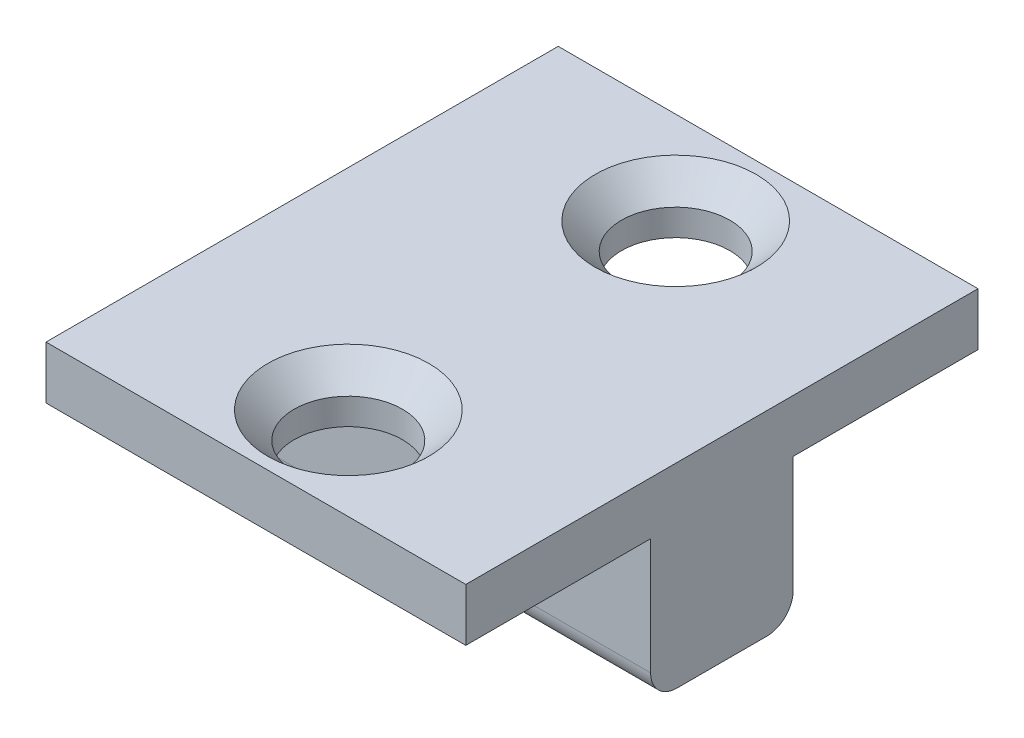
from build123d import *

# Parameters (mm, degrees)
SKETCH_1_W          = 15.9
SKETCH_1_H          = 5.4
EXTRUDE_1_DEPTH     = 5.4
SKETCH_2_W          = 15.9
SKETCH_2_H          = 19.4
EXTRUDE_2_DEPTH     = 2
SKETCH_3_R          = 2.05
CUT_EXTRUDE_2_DEPTH = 14.654761074
CHAMFER_1_SIZE      = 1
FILLET_1_R          = 1


with BuildPart() as part:
    # 草图1 → 凸台-拉伸1 (new body)
    with BuildSketch(Plane(origin=(0, 0, 0), x_dir=(1, 0, 0), z_dir=(0, 1, 0))):
        Rectangle(SKETCH_1_W, SKETCH_1_H)
    extrude(amount=EXTRUDE_1_DEPTH)

    # 草图2 → 凸台-拉伸2 (add)
    with BuildSketch(Plane(origin=(0, 5.4, 0), x_dir=(1, 0, 0), z_dir=(0, 1, 0))):
        Rectangle(SKETCH_2_W, SKETCH_2_H)
    extrude(amount=EXTRUDE_2_DEPTH)

    # 草图3 → 切除-拉伸2 (cut, through all)
    with BuildSketch(Plane(origin=(0, 5.4, 0), x_dir=(-1, 0, 0), z_dir=(0, -1, 0))):
        with Locations(Location((0, 6.2, 0), (0, 0, 90))):
            Circle(SKETCH_3_R)
    cut_extrude_2 = extrude(amount=-CUT_EXTRUDE_2_DEPTH, mode=Mode.SUBTRACT)

    # 镜向2: 切除-拉伸2 across plane
    add(cut_extrude_2.mirror(Plane.XY), mode=Mode.SUBTRACT)

    # 倒角1
    chamfer_1_edges = [part.edges().sort_by_distance(p)[0] for p in [
        (0, 7.4, -4.15),
        (0, 7.4, 4.15),
    ]]
    chamfer(chamfer_1_edges, length=CHAMFER_1_SIZE)

    # 圆角1
    fillet_1_edges = [part.edges().sort_by_distance(p)[0] for p in [
        (0, 0, 2.7),
        (0, 0, -2.7),
    ]]
    fillet(fillet_1_edges, radius=FILLET_1_R)


solid = part.part
